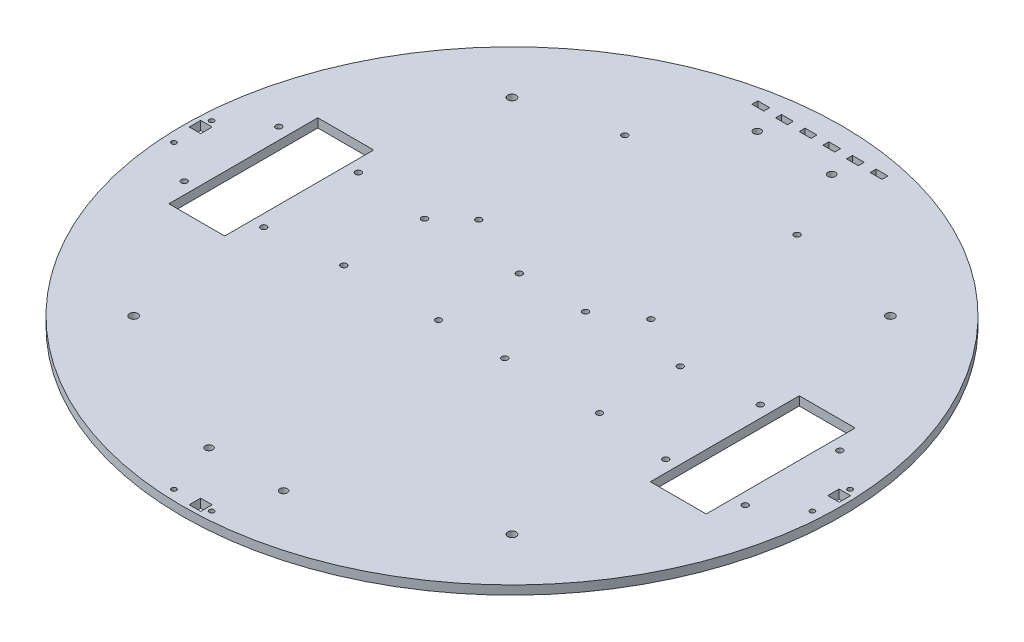
from build123d import *

# Parameters (mm, degrees)
SKETCH1_R           = 177
SKETCH1_R_2         = 1.6
SKETCH1_R_3         = 2.2479
SKETCH1_R_4         = 2.000000064
SKETCH1_R_5         = 1.3
SKETCH1_R_6         = 1.29999994
SKETCH1_W           = 6.15
SKETCH1_H           = 6.15
SKETCH1_W_2         = 30
SKETCH1_H_2         = 80
SKETCH1_W_3         = 6.35
SKETCH1_H_3         = 3.175
BOSS_EXTRUDE1_DEPTH = 4.7625
SKETCH2_R           = 1.599999975
CUT_EXTRUDE1_DEPTH  = 251.361102023


with BuildPart() as part:
    # Sketch1 → Boss-Extrude1 (new body)
    with BuildSketch(Plane(origin=(0, 0, 0), x_dir=(1, 0, 0), z_dir=(0, 1, 0))):
        with Locations(Location((0, 0, 0), (0, 0, 90))):
            Circle(SKETCH1_R)
        with Locations(Location((-150.65, 25.4, 0), (0, 0, 90))):
            Circle(SKETCH1_R_2, mode=Mode.SUBTRACT)
        with Locations(Location((-150.65, -25.4, 0), (0, 0, 90))):
            Circle(SKETCH1_R_2, mode=Mode.SUBTRACT)
        with Locations(Location((150.65, 25.4, 0), (0, 0, 90))):
            Circle(SKETCH1_R_2, mode=Mode.SUBTRACT)
        with Locations(Location((150.65, -25.4, 0), (0, 0, 90))):
            Circle(SKETCH1_R_2, mode=Mode.SUBTRACT)
        with Locations(Location((-107.95, 25.4, 0), (0, 0, 90))):
            Circle(SKETCH1_R_2, mode=Mode.SUBTRACT)
        with Locations(Location((-107.95, -25.4, 0), (0, 0, 90))):
            Circle(SKETCH1_R_2, mode=Mode.SUBTRACT)
        with Locations(Location((107.95, 25.4, 0), (0, 0, 90))):
            Circle(SKETCH1_R_2, mode=Mode.SUBTRACT)
        with Locations(Location((107.95, -25.4, 0), (0, 0, 90))):
            Circle(SKETCH1_R_2, mode=Mode.SUBTRACT)
        with Locations(Location((-53.7, 114.3, 0), (0, 0, 90))):
            Circle(SKETCH1_R_2, mode=Mode.SUBTRACT)
        with Locations(Location((38.8, 114.3, 0), (0, 0, 90))):
            Circle(SKETCH1_R_2, mode=Mode.SUBTRACT)
        with Locations(Location((-53.7, 35.8, 0), (0, 0, 90))):
            Circle(SKETCH1_R_2, mode=Mode.SUBTRACT)
        with Locations(Location((38.8, 35.8, 0), (0, 0, 90))):
            Circle(SKETCH1_R_2, mode=Mode.SUBTRACT)
        with Locations(Location((-101.6, -101.6, 0), (0, 0, 90))):
            Circle(SKETCH1_R_3, mode=Mode.SUBTRACT)
        with Locations(Location((101.6, -101.6, 0), (0, 0, 90))):
            Circle(SKETCH1_R_3, mode=Mode.SUBTRACT)
        with Locations(Location((-101.6, 101.6, 0), (0, 0, 90))):
            Circle(SKETCH1_R_3, mode=Mode.SUBTRACT)
        with Locations(Location((101.6, 101.6, 0), (0, 0, 90))):
            Circle(SKETCH1_R_3, mode=Mode.SUBTRACT)
        with Locations(Location((-20, -142.687006289, 0), (0, 0, 90))):
            Circle(SKETCH1_R_4, mode=Mode.SUBTRACT)
        with Locations(Location((20, -142.687006289, 0), (0, 0, 90))):
            Circle(SKETCH1_R_4, mode=Mode.SUBTRACT)
        with Locations(Location((-20, 151.719279026, 0), (0, 0, 90))):
            Circle(SKETCH1_R_4, mode=Mode.SUBTRACT)
        with Locations(Location((20, 151.719279026, 0), (0, 0, 90))):
            Circle(SKETCH1_R_4, mode=Mode.SUBTRACT)
        with Locations(Location((-10.125, -171.45, 0), (0, 0, 90))):
            Circle(SKETCH1_R_5, mode=Mode.SUBTRACT)
        with Locations(Location((10.125, -171.45, 0), (0, 0, 90))):
            Circle(SKETCH1_R_6, mode=Mode.SUBTRACT)
        with Locations(Location((171.45, -10.125, 0), (0, 0, 90))):
            Circle(SKETCH1_R_5, mode=Mode.SUBTRACT)
        with Locations(Location((171.45, 10.125, 0), (0, 0, 90))):
            Circle(SKETCH1_R_5, mode=Mode.SUBTRACT)
        with Locations(Location((-171.45, -10.125, 0), (0, 0, 90))):
            Circle(SKETCH1_R_5, mode=Mode.SUBTRACT)
        with Locations(Location((-171.45, 10.125, 0), (0, 0, 90))):
            Circle(SKETCH1_R_5, mode=Mode.SUBTRACT)
        with Locations((171.45, 4.26)):
            Rectangle(SKETCH1_W, SKETCH1_H, mode=Mode.SUBTRACT)
        with Locations((-129.3, 0)):
            Rectangle(SKETCH1_W_2, SKETCH1_H_2, mode=Mode.SUBTRACT)
        with Locations((129.3, 0)):
            Rectangle(SKETCH1_W_2, SKETCH1_H_2, mode=Mode.SUBTRACT)
        with Locations((4.26, -171.45)):
            Rectangle(SKETCH1_W, SKETCH1_H, mode=Mode.SUBTRACT)
        with Locations((-171.45, 4.26)):
            Rectangle(SKETCH1_W, SKETCH1_H, mode=Mode.SUBTRACT)
        with Locations((-18.119952608, 164.452014647)):
            Rectangle(SKETCH1_W_3, SKETCH1_H_3, mode=Mode.SUBTRACT)
        with Locations((-30.819952608, 164.452014647)):
            Rectangle(SKETCH1_W_3, SKETCH1_H_3, mode=Mode.SUBTRACT)
        with Locations((-5.419952608, 164.452014647)):
            Rectangle(SKETCH1_W_3, SKETCH1_H_3, mode=Mode.SUBTRACT)
        with Locations((7.280047392, 164.452014647)):
            Rectangle(SKETCH1_W_3, SKETCH1_H_3, mode=Mode.SUBTRACT)
        with Locations((19.980047392, 164.452014647)):
            Rectangle(SKETCH1_W_3, SKETCH1_H_3, mode=Mode.SUBTRACT)
        with Locations((32.680047392, 164.452014647)):
            Rectangle(SKETCH1_W_3, SKETCH1_H_3, mode=Mode.SUBTRACT)
    extrude(amount=BOSS_EXTRUDE1_DEPTH)

    # Sketch2 → Cut-Extrude1 (cut, through all)
    with BuildSketch(Plane(origin=(0, 4.7625, 0), x_dir=(1, 0, 0), z_dir=(0, 1, 0))):
        with Locations(Location((17.78, 21.689999946, 0), (0, 0, 270))):
            Circle(SKETCH2_R)
        with Locations(Location((17.78, -21.690000054, 0), (0, 0, 270))):
            Circle(SKETCH2_R)
        with Locations(Location((68.660000006, -21.690000054, 0), (0, 0, 270))):
            Circle(SKETCH2_R)
        with Locations(Location((68.660000006, 21.689999946, 0), (0, 0, 270))):
            Circle(SKETCH2_R)
        with Locations(Location((-68.660000006, 21.689999946, 0), (0, 0, 270))):
            Circle(SKETCH2_R)
        with Locations(Location((-68.660000006, -21.690000054, 0), (0, 0, 270))):
            Circle(SKETCH2_R)
        with Locations(Location((-17.78, -21.690000054, 0), (0, 0, 270))):
            Circle(SKETCH2_R)
        with Locations(Location((-17.78, 21.689999946, 0), (0, 0, 270))):
            Circle(SKETCH2_R)
    extrude(amount=-CUT_EXTRUDE1_DEPTH, mode=Mode.SUBTRACT)


solid = part.part
